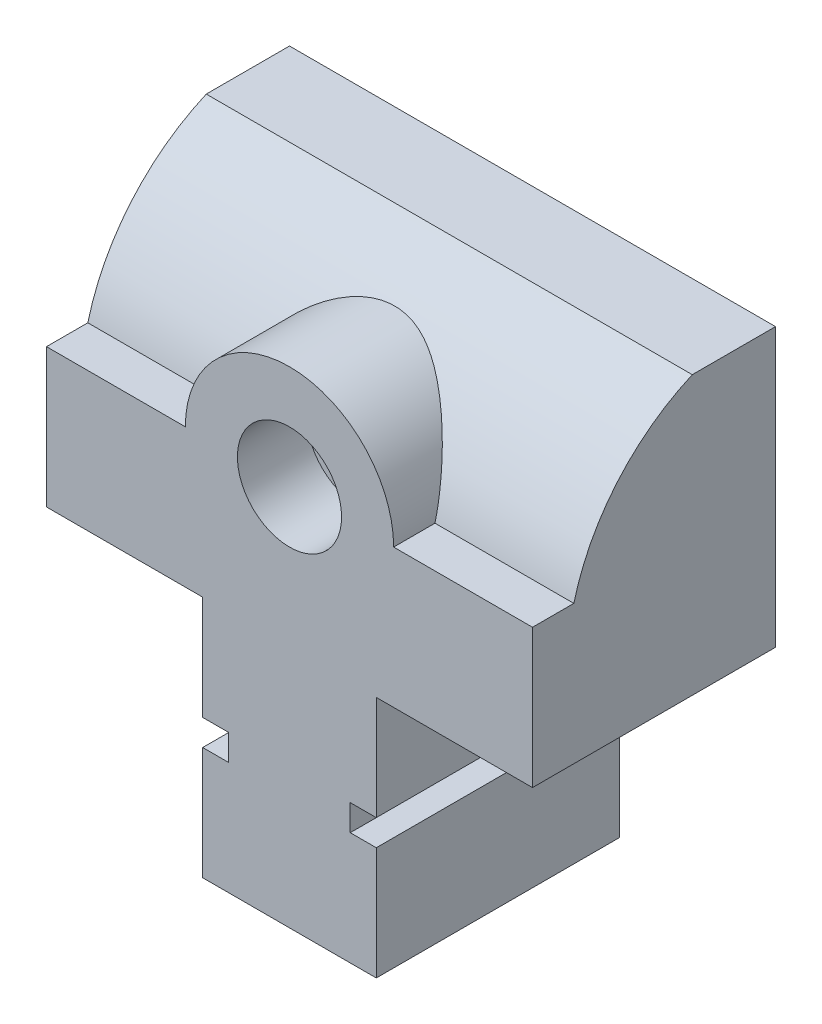
from build123d import *

# Parameters (mm, degrees)
BOSS_EXTRUDE1_DEPTH = 44.45
BOSS_EXTRUDE2_DEPTH = 88.9
SKETCH3_R           = 9.525
CUT_EXTRUDE1_DEPTH  = 12.7
SKETCH4_W           = 4.7625
SKETCH4_H           = 4.7625
CUT_EXTRUDE2_DEPTH  = 122.191875372


with BuildPart() as part:
    # Sketch1 → Boss-Extrude1 (new body)
    with BuildSketch(Plane.XY):
        with BuildLine():
            Line((0, 0), (31.75, 0))
            Line((31.75, 0), (31.75, 44.45))
            Line((31.75, 44.45), (60.325, 44.45))
            Line((60.325, 44.45), (60.325, 69.85))
            Line((60.325, 69.85), (34.925, 69.85))
            ThreePointArc((34.925, 69.85), (15.875, 88.9), (-3.175, 69.85))
            Line((-3.175, 69.85), (-28.575, 69.85))
            Line((-28.575, 69.85), (-28.575, 44.45))
            Line((-28.575, 44.45), (0, 44.45))
            Line((0, 44.45), (0, 0))
        make_face()
    extrude(amount=-BOSS_EXTRUDE1_DEPTH)

    # Sketch2 → Boss-Extrude2 (add)
    with BuildSketch(Plane.ZY.offset(28.575)):
        with BuildLine():
            Line((-44.45, 95.25), (-44.45, 69.85))
            Line((-44.45, 69.85), (-7.559833627, 69.85))
            ThreePointArc((-7.559833627, 69.85), (-15.461491308, 85.049003798), (-29.223234913, 95.25))
            Line((-29.223234913, 95.25), (-44.45, 95.25))
        make_face()
    extrude(amount=-BOSS_EXTRUDE2_DEPTH)

    # Sketch3 → Cut-Extrude1 (cut)
    with BuildSketch(Plane.XY):
        with Locations((15.875, 69.85)):
            Circle(SKETCH3_R)
    extrude(amount=-CUT_EXTRUDE1_DEPTH, mode=Mode.SUBTRACT)

    # Sketch4 → Cut-Extrude2 (cut, through all)
    with BuildSketch(Plane.XY):
        with Locations((2.38125, 23.01875)):
            Rectangle(SKETCH4_W, SKETCH4_H)
        with Locations((29.36875, 23.01875)):
            Rectangle(SKETCH4_W, SKETCH4_H)
    extrude(amount=-CUT_EXTRUDE2_DEPTH, mode=Mode.SUBTRACT)


solid = part.part
